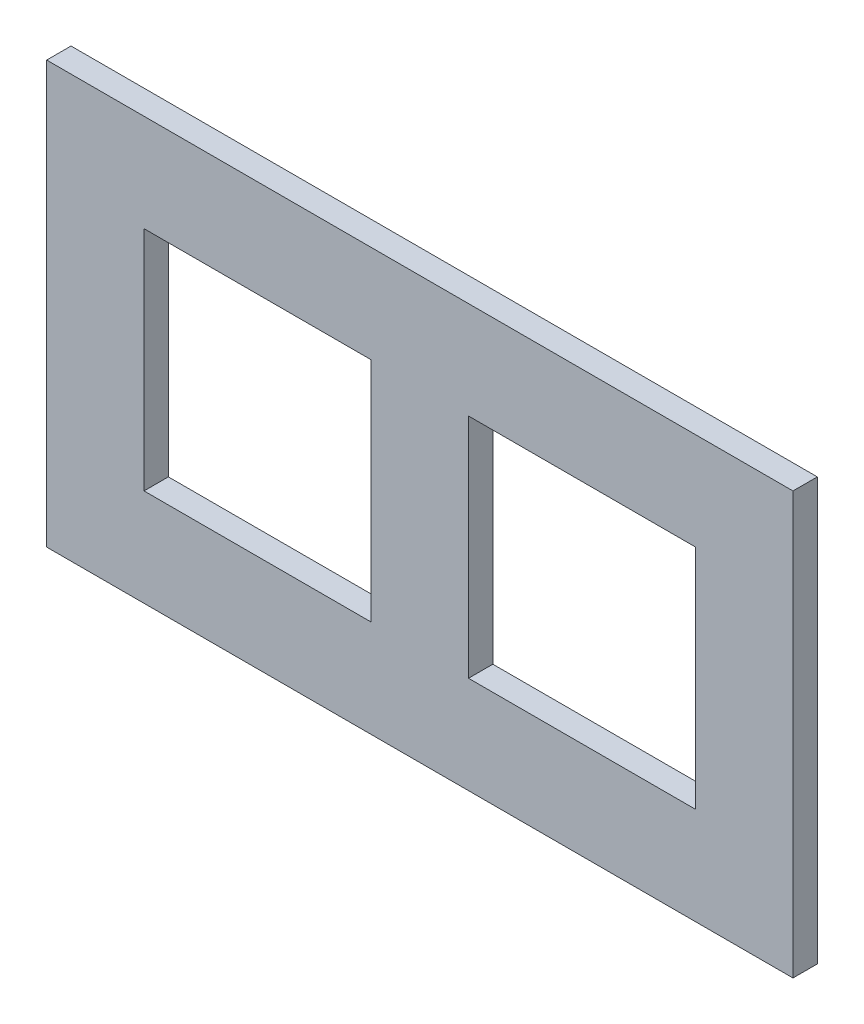
from build123d import *

# Parameters (mm, degrees)
SKETCH1_W           = 46
SKETCH1_H           = 26
SKETCH1_W_2         = 14
SKETCH1_H_2         = 14
BOSS_EXTRUDE1_DEPTH = 1.5


with BuildPart() as part:
    # Sketch1 → Boss-Extrude1 (new body)
    with BuildSketch(Plane.XY):
        with Locations((-23, 13)):
            Rectangle(SKETCH1_W, SKETCH1_H)
        with Locations((-33, 13)):
            Rectangle(SKETCH1_W_2, SKETCH1_H_2, mode=Mode.SUBTRACT)
        with Locations((-13, 13)):
            Rectangle(SKETCH1_W_2, SKETCH1_H_2, mode=Mode.SUBTRACT)
    extrude(amount=BOSS_EXTRUDE1_DEPTH)


solid = part.part
